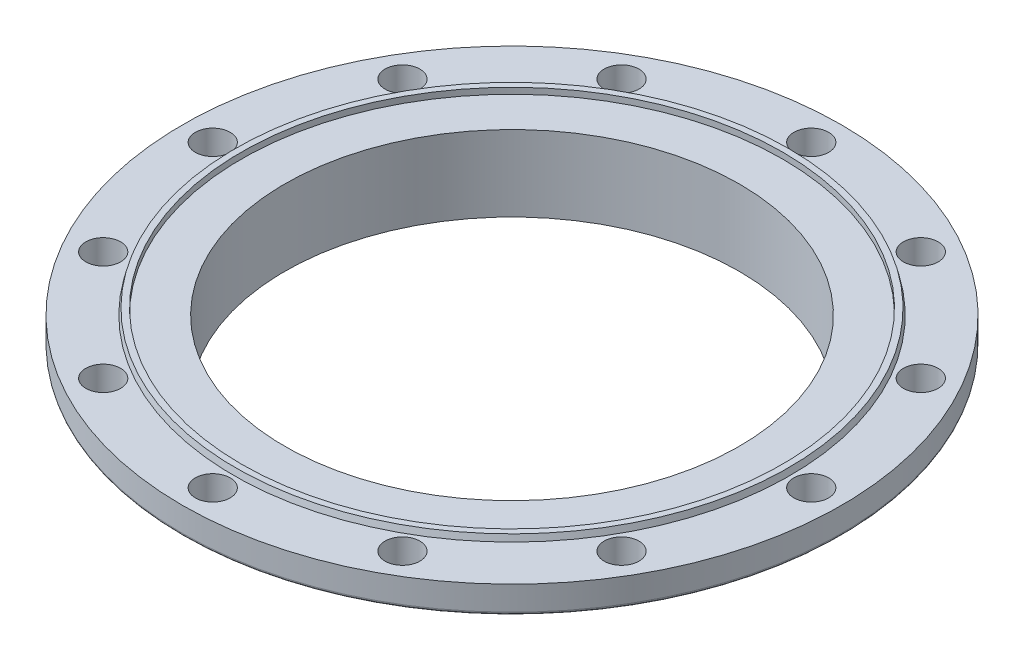
from build123d import *

# Parameters (mm, degrees)
SKETCH_2_R          = 11.5
CUT_EXTRUDE_1_DEPTH = 312.628785577


with BuildPart() as part:
    # Эскиз1 → Повернуть1 (revolve)
    with BuildSketch(Plane.XY, mode=Mode.PRIVATE) as revolve_1_sk:
        with BuildLine():
            Line((-150, 0), (-150, 50))
            Line((-150, 50), (-178.5, 50))
            Line((-178.5, 50), (-178.5, 54))
            Line((-178.5, 54), (-182.5, 54))
            Line((-182.5, 54), (-183.5, 50))
            Line((-183.5, 50), (-217.5, 50))
            Line((-217.5, 50), (-217.5, 34))
            ThreePointArc((-217.5, 34), (-216.914213562, 32.585786438), (-215.5, 32))
            Line((-215.5, 32), (-175.991183949, 32))
            ThreePointArc((-175.991183949, 32), (-171.439506628, 30.318104321), (-169.075099713, 26.080638162))
            Line((-169.075099713, 26.080638162), (-165, 0))
            Line((-165, 0), (-150, 0))
        make_face()
    revolve(revolve_1_sk.sketch.rotate(Axis((0, 0, 0), (0, 1, 0)), 270), axis=Axis((0, 0, 0), (0, 1, 0)))

    # Эскиз2 → Вырез-Вытянуть1 (cut, through all)
    with BuildSketch(Plane(origin=(0, 50, 0), x_dir=(1, 0, 0), z_dir=(0, 1, 0))):
        with Locations(Location((-197.5, 0, 0), (0, 0, 270))):
            Circle(SKETCH_2_R)
        with Locations(Location((-171.040017247, 98.75, 0), (0, 0, 270))):
            Circle(SKETCH_2_R)
        with Locations(Location((-98.75, 171.040017247, 0), (0, 0, 270))):
            Circle(SKETCH_2_R)
        with Locations(Location((0, 197.5, 0), (0, 0, 270))):
            Circle(SKETCH_2_R)
        with Locations(Location((98.75, 171.040017247, 0), (0, 0, 270))):
            Circle(SKETCH_2_R)
        with Locations(Location((171.040017247, 98.75, 0), (0, 0, 270))):
            Circle(SKETCH_2_R)
        with Locations(Location((197.5, 0, 0), (0, 0, 270))):
            Circle(SKETCH_2_R)
        with Locations(Location((171.040017247, -98.75, 0), (0, 0, 270))):
            Circle(SKETCH_2_R)
        with Locations(Location((98.75, -171.040017247, 0), (0, 0, 270))):
            Circle(SKETCH_2_R)
        with Locations(Location((0, -197.5, 0), (0, 0, 270))):
            Circle(SKETCH_2_R)
        with Locations(Location((-98.75, -171.040017247, 0), (0, 0, 270))):
            Circle(SKETCH_2_R)
        with Locations(Location((-171.040017247, -98.75, 0), (0, 0, 270))):
            Circle(SKETCH_2_R)
    extrude(amount=-CUT_EXTRUDE_1_DEPTH, mode=Mode.SUBTRACT)


solid = part.part
